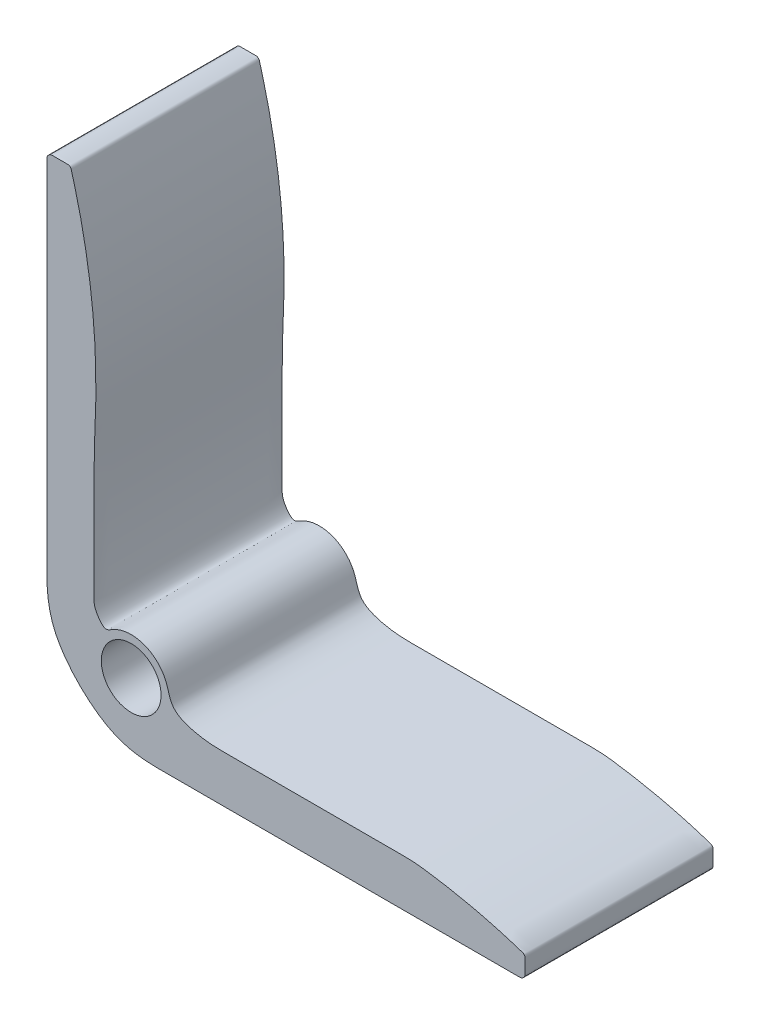
from build123d import *

# Parameters (mm, degrees)
CROQUIS1_R              = 3.175
SALIENTE_EXTRUIR1_DEPTH = 20


with BuildPart() as part:
    # Croquis1 → Saliente-Extruir1 (new body)
    with BuildSketch(Plane.XY):
        with BuildLine():
            add(Edge.make_bspline(
                [(-24.952959717, -13.147040283), (-24.952959717, -0.655373616), (-24.952959717, 11.83629305), (-24.952959717, 24.327959717), (-24.952959717, 24.426168992), (-24.952959717, 24.622587543), (-24.622587543, 24.952959717), (-24.426168992, 24.952959717), (-24.327959717, 24.952959717), (-23.91129305, 24.952959717), (-23.494626384, 24.952959717), (-23.077959717, 24.952959717), (-23.043142218, 24.952959717), (-22.97350722, 24.952959717), (-22.869054722, 24.952959717), (-22.799419724, 24.952959717), (-22.764602225, 24.952959717), (-22.709148747, 24.952959717), (-22.598241792, 24.952959717), (-22.41187841, 24.812600957), (-22.381252755, 24.706006295), (-22.365939927, 24.652708964), (-22.356348518, 24.619325418), (-22.337165701, 24.552558326), (-22.308675569, 24.452326031), (-22.289751165, 24.385485214), (-22.280314824, 24.352057504), (-20.674036496, 18.66190629), (-19.826648109, 12.810420681), (-19.752740886, 6.898357704), (-19.73761759, 5.688599355), (-19.772572246, 3.268267568), (-19.952959717, -0.358918598), (-19.952959717, -2.778624348), (-19.952959717, -3.988477223), (-19.952959717, -7.180668815), (-19.952959717, -10.372860407), (-19.952959717, -13.565051999), (-19.952959717, -13.867170976), (-19.952959717, -14.471408931), (-18.823412847, -16.073354355), (-18.343737076, -15.699588374), (-18.086034143, -15.541901739), (-15.804711476, -14.145976236), (-13.267537878, -14.99202071), (-12.280599223, -17.477778786), (-11.983415009, -18.226283323), (-11.841148801, -19.902793837), (-8.279241627, -20.847040283), (-6.66855544, -20.847040283), (-5.863212346, -20.847040283), (-0.267522349, -20.847040283), (5.328167648, -20.847040283), (10.923857644, -20.847040283), (11.124759829, -20.847040283), (11.526564198, -20.847040283), (12.129270752, -20.847040283), (12.531075121, -20.847040283), (12.731977306, -20.847040283), (13.038363803, -20.847040283), (13.651136797, -20.847040283), (14.572560068, -20.911990524), (15.179273792, -20.997950971), (15.482630655, -21.040931195), (15.6502684, -21.064682455), (15.985543891, -21.112184976), (16.487315973, -21.191527899), (16.821472374, -21.246371764), (16.988427091, -21.274525957), (19.803284425, -21.749205788), (22.575425408, -22.430364446), (25.289725699, -23.31428564), (25.320739319, -23.324385332), (25.382749493, -23.344637124), (25.475730917, -23.375119728), (25.537654959, -23.395633302), (25.56861698, -23.405890089), (25.618776397, -23.422506396), (25.719095231, -23.455739011), (25.847040283, -23.632906036), (25.847040283, -23.738586097), (25.847040283, -23.791426127), (25.847040283, -23.824149944), (25.847040283, -23.889597578), (25.847040283, -23.987769029), (25.847040283, -24.053216663), (25.847040283, -24.08594048), (25.847040283, -24.477295992), (25.847040283, -24.868651504), (25.847040283, -25.260007015), (25.847040283, -25.352250394), (25.847040283, -25.536737152), (25.536737152, -25.847040283), (25.352250394, -25.847040283), (25.260007015, -25.847040283), (12.755684771, -25.847040283), (0.251362527, -25.847040283), (-12.252959717, -25.847040283), (-14.248572188, -25.847040283), (-18.239797131, -25.847040283), (-24.952959717, -19.133877697), (-24.952959717, -15.142652754), (-24.952959717, -13.147040283)],
                knots=[0, 0, 0, 0, 0.202690425, 0.202690425, 0.202690425, 0.204283974, 0.205877523, 0.207471071, 0.207471071, 0.207471071, 0.214231926, 0.214231926, 0.214231926, 0.214796877, 0.215361827, 0.215926778, 0.215926778, 0.215926778, 0.216826569, 0.21772636, 0.218626151, 0.218626151, 0.218626151, 0.219189748, 0.219753344, 0.220316941, 0.220316941, 0.220316941, 0.315703227, 0.315703227, 0.315703227, 0.335334362, 0.354965497, 0.374596632, 0.374596632, 0.374596632, 0.426393296, 0.426393296, 0.426393296, 0.431295494, 0.436197692, 0.441099891, 0.441099891, 0.441099891, 0.474199398, 0.474199398, 0.474199398, 0.487266936, 0.500334475, 0.513402013, 0.513402013, 0.513402013, 0.604197967, 0.604197967, 0.604197967, 0.607457816, 0.610717665, 0.613977514, 0.613977514, 0.613977514, 0.618948957, 0.6239204, 0.628891843, 0.628891843, 0.628891843, 0.631639108, 0.634386372, 0.637133636, 0.637133636, 0.637133636, 0.683368291, 0.683368291, 0.683368291, 0.683897531, 0.684426771, 0.684956011, 0.684956011, 0.684956011, 0.685813396, 0.686670781, 0.687528166, 0.687528166, 0.687528166, 0.688059145, 0.688590123, 0.689121101, 0.689121101, 0.689121101, 0.695471256, 0.695471256, 0.695471256, 0.696968002, 0.698464748, 0.699961493, 0.699961493, 0.699961493, 0.902857269, 0.902857269, 0.902857269, 0.935238179, 0.96761909, 1, 1, 1, 1], degree=3, weights=[1, 1, 1, 1, 1, 1, 1, 1, 1, 1, 1, 1, 1, 1, 1, 1, 1, 1, 1, 1, 1, 1, 1, 1, 1, 1, 1, 0.994260316, 0.994260316, 1, 1, 1, 1, 1, 1, 1, 1, 1, 1, 1, 1, 1, 1, 0.762716818, 0.762716818, 1, 1, 1, 1, 1, 1, 1, 1, 1, 1, 1, 1, 1, 1, 1, 1, 1, 1, 1, 1, 1, 1, 1, 1, 0.998181388, 0.998181388, 1, 1, 1, 1, 1, 1, 1, 1, 1, 1, 1, 1, 1, 1, 1, 1, 1, 1, 1, 1, 1, 1, 1, 1, 1, 1, 1, 1, 1, 1, 1, 1]))
        make_face()
        with Locations((-15.998291931, -18.95384143)):
            Circle(CROQUIS1_R, mode=Mode.SUBTRACT)
    extrude(amount=SALIENTE_EXTRUIR1_DEPTH)


solid = part.part
